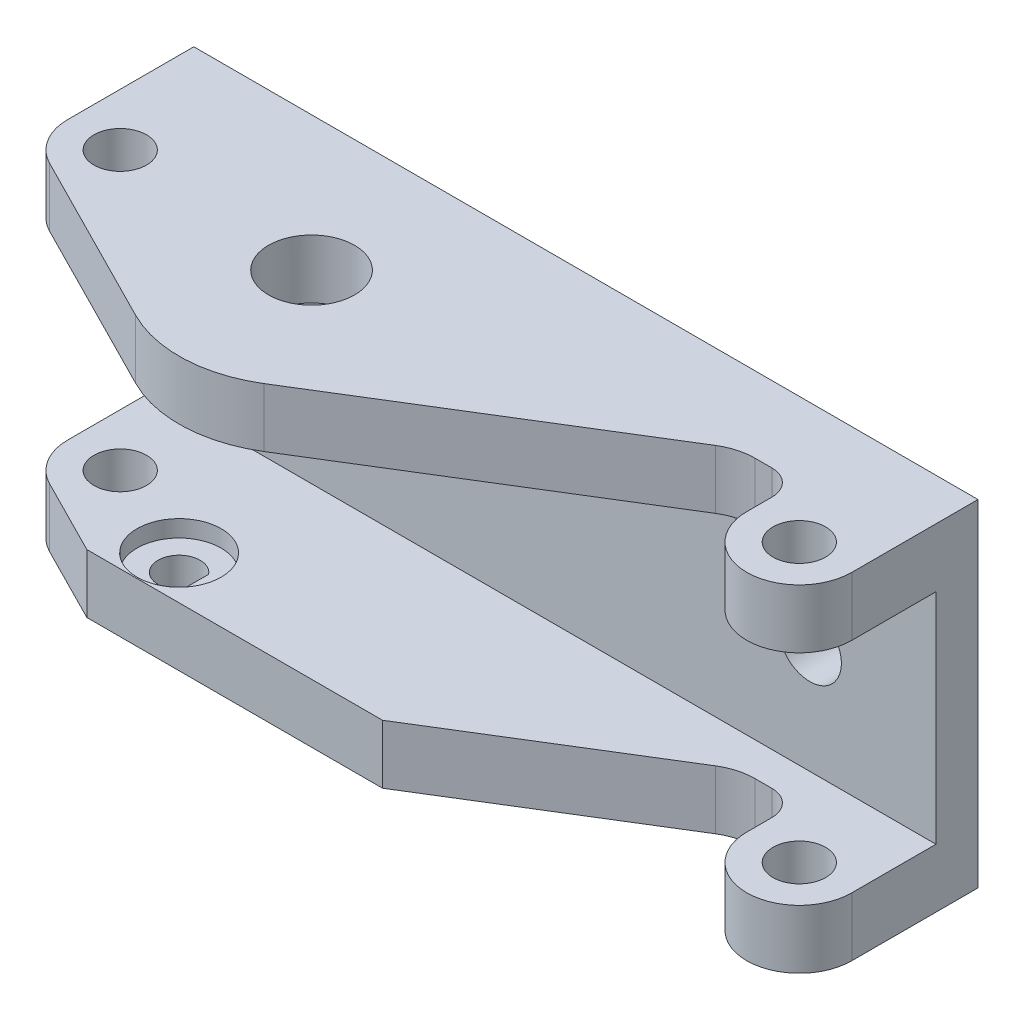
from build123d import *

# Parameters (mm, degrees)
BOSS_EXTRUDE1_DEPTH = 118.4275
SKETCH3_R           = 3.96875
SKETCH3_R_2         = 6.5
CUT_EXTRUDE1_DEPTH  = 25.4
SKETCH6_R           = 3.96875
CUT_EXTRUDE3_DEPTH  = 8.89
SKETCH4_R           = 4.7625
CUT_EXTRUDE2_DEPTH  = 6.35
SKETCH7_R           = 6.35
CUT_EXTRUDE4_DEPTH  = 2.54


with BuildPart() as part:
    # Sketch2 → Boss-Extrude1 (new body)
    with BuildSketch(Plane(origin=(0, 0, 0), x_dir=(0, 0, -1), z_dir=(1, 0, 0))):
        Polygon((0, -25.4), (0, 25.4), (-63.5, 25.4), (-63.5, 16.51), (-6.35, 16.51), (-6.35, -16.51), (-63.5, -16.51), (-63.5, -25.4), align=None)
    extrude(amount=BOSS_EXTRUDE1_DEPTH)

    # Sketch3 → Cut-Extrude1 (cut)
    with BuildSketch(Plane(origin=(0, 0, 0), x_dir=(1, 0, 0), z_dir=(0, 1, 0))):
        with Locations(Location((7.9375, -19.05, 0), (0, 0, 90))):
            Circle(SKETCH3_R)
        with Locations(Location((110.49, -19.05, 0), (0, 0, 90))):
            Circle(SKETCH3_R)
        with Locations(Location((38.1, -20.32, 0), (0, 0, 90))):
            Circle(SKETCH3_R_2)
        with BuildLine():
            Line((0, -63.5), (0, -19.05))
            ThreePointArc((0, -19.05), (1.173211717, -23.203108508), (4.346030936, -26.128506637))
            Line((4.346030936, -26.128506637), (30.73922523, -39.519797436))
            ThreePointArc((30.73922523, -39.519797436), (40.148824549, -41.564990827), (49.356556182, -38.747003333))
            Line((49.356556182, -38.747003333), (91.51717293, -12.752709815))
            ThreePointArc((91.51717293, -12.752709815), (93.758058641, -11.767067469), (96.182815356, -11.43))
            Line((96.182815356, -11.43), (98.7425, -11.43))
            ThreePointArc((98.7425, -11.43), (101.436576836, -12.545923164), (102.5525, -15.24))
            Line((102.5525, -15.24), (102.5525, -19.05))
            ThreePointArc((102.5525, -19.05), (110.49, -26.9875), (118.4275, -19.05))
            Line((118.4275, -19.05), (118.4275, -63.5))
            Line((118.4275, -63.5), (0, -63.5))
        make_face()
    extrude(amount=CUT_EXTRUDE1_DEPTH, mode=Mode.SUBTRACT)

    # Sketch6 → Cut-Extrude3 (cut)
    with BuildSketch(Plane.XZ.offset(25.4)):
        with Locations(Location((110.49, 19.05, 0), (0, 0, 270))):
            Circle(SKETCH6_R)
        with Locations(Location((7.9375, 19.05, 0), (0, 0, 270))):
            Circle(SKETCH6_R)
        with BuildLine():
            Line((0, 19.05), (0, 63.5))
            Line((0, 63.5), (118.4275, 63.5))
            Line((118.4275, 63.5), (118.4275, 19.05))
            ThreePointArc((118.4275, 19.05), (110.49, 26.9875), (102.5525, 19.05))
            Line((102.5525, 19.05), (102.5525, 15.24))
            ThreePointArc((102.5525, 15.24), (101.436576836, 12.545923164), (98.7425, 11.43))
            Line((98.7425, 11.43), (96.182815356, 11.43))
            ThreePointArc((96.182815356, 11.43), (93.758058641, 11.767067469), (91.51717293, 12.752709815))
            Line((91.51717293, 12.752709815), (60.419932998, 31.92583499))
            Line((60.419932998, 31.92583499), (15.772114941, 31.92583499))
            Line((15.772114941, 31.92583499), (4.346030936, 26.128506637))
            ThreePointArc((4.346030936, 26.128506637), (1.173211717, 23.203108508), (0, 19.05))
        make_face()
        with BuildLine():
            Line((25.6667, 27.370915615), (25.6667, 23.429084385))
            ThreePointArc((25.6667, 23.429084385), (20.0025, 25.4), (25.6667, 27.370915615))
        make_face()
    extrude(amount=-CUT_EXTRUDE3_DEPTH, mode=Mode.SUBTRACT)

    # Sketch4 → Cut-Extrude2 (cut)
    with BuildSketch(Plane.XY):
        with Locations(Location((19.05, 0, 0), (0, 0, 180))):
            Circle(SKETCH4_R)
        with Locations(Location((99.3775, 0, 0), (0, 0, 180))):
            Circle(SKETCH4_R)
    extrude(amount=CUT_EXTRUDE2_DEPTH, mode=Mode.SUBTRACT)

    # Sketch7 → Cut-Extrude4 (cut)
    with BuildSketch(Plane(origin=(0, -16.51, 0), x_dir=(1, 0, 0), z_dir=(0, 1, 0))):
        with Locations(Location((23.1775, -25.4, 0), (0, 0, 270))):
            Circle(SKETCH7_R)
    extrude(amount=-CUT_EXTRUDE4_DEPTH, mode=Mode.SUBTRACT)


solid = part.part
